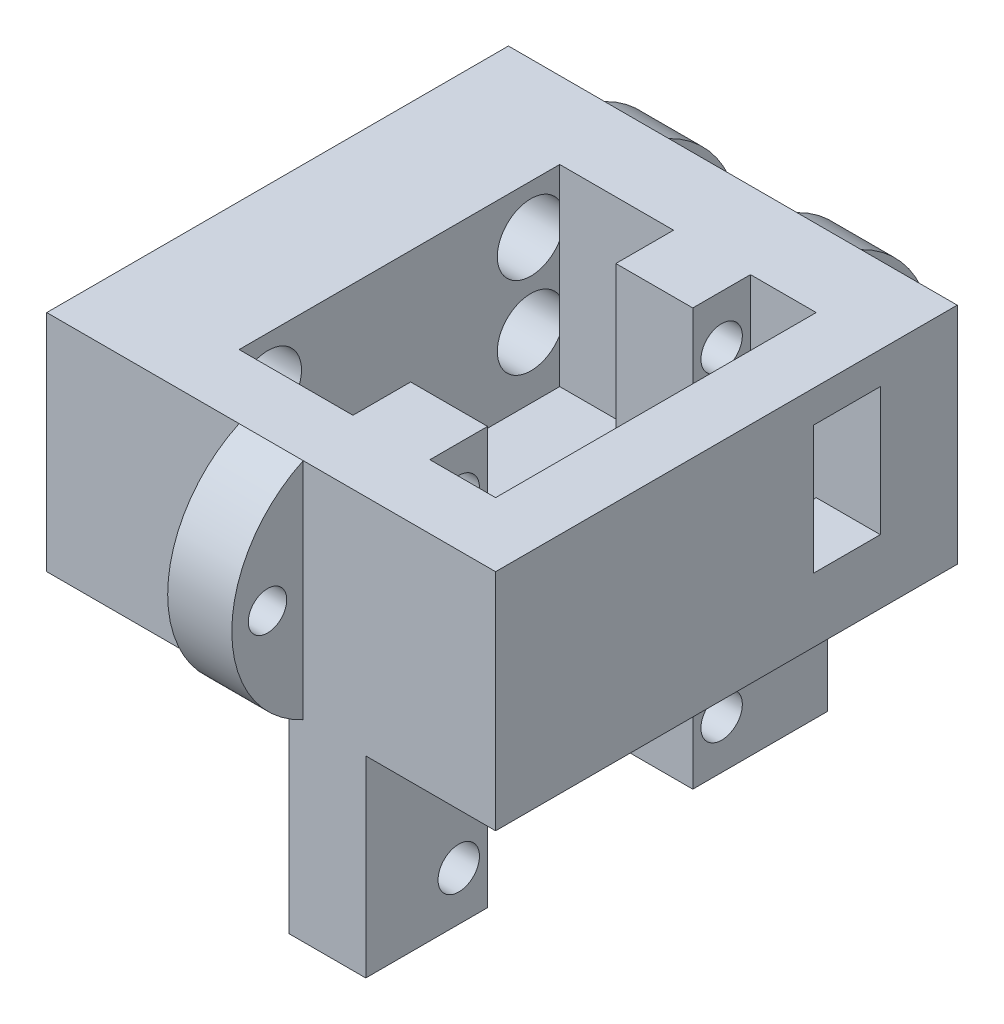
from build123d import *

# Parameters (mm, degrees)
SKETCH1_W                = 88.9
SKETCH1_H                = 91.44
BOSS_EXTRUDE1_DEPTH      = 44.45
CUT_EXTRUDE1_DEPTH       = 38.1
CUT_EXTRUDE2_DEPTH       = 15.24
SKETCH4_R                = 6.64
CUT_EXTRUDE3_DEPTH       = 25.4
SKETCH5_W                = 13.209891204
SKETCH5_H                = 25.4
CUT_EXTRUDE4_DEPTH       = 12.7
BOSS_EXTRUDE2_DEPTH      = 25.4
BOSS_EXTRUDE2_DEPTH_BACK = 25.4
CUT_EXTRUDE6_DEPTH       = 45.72
CUT_EXTRUDE6_DEPTH_BACK  = 2.54
SKETCH9_W                = 12.7
SKETCH9_H                = 18.221589608
BOSS_EXTRUDE4_DEPTH      = 6.35
BOSS_EXTRUDE4_DEPTH_BACK = 6.35
BOSS_EXTRUDE6_DEPTH      = 38.1
SKETCH12_R               = 4.1
CUT_EXTRUDE7_DEPTH       = 98.736331214


with BuildPart() as part:
    # Sketch1 → Boss-Extrude1 (new body)
    with BuildSketch(Plane(origin=(0, 0, 0), x_dir=(1, 0, 0), z_dir=(0, 1, 0))):
        Rectangle(SKETCH1_W, SKETCH1_H)
    extrude(amount=BOSS_EXTRUDE1_DEPTH)

    # Sketch2 → Cut-Extrude1 (cut)
    with BuildSketch(Plane(origin=(0, 44.45, 0), x_dir=(1, 0, 0), z_dir=(0, 1, 0))):
        Polygon((-19.05, 30.48), (-19.05, -33.02), (3.496943095, -33.02), (3.496943095, -21.59), (18.736943095, -21.59), (18.736943095, -33.02), (31.75, -33.02), (31.75, 30.48), (18.736943095, 30.48), (18.736943095, 19.05), (3.496943095, 19.05), (3.496943095, 30.48), align=None)
    extrude(amount=-CUT_EXTRUDE1_DEPTH, mode=Mode.SUBTRACT)

    # Sketch3 → Cut-Extrude2 (cut)
    with BuildSketch(Plane.ZY.offset(-3.496943095)):
        with BuildLine():
            ThreePointArc((-24.765, 22.642), (-28.865, 18.542), (-24.765, 14.442))
            Line((-24.765, 14.442), (-24.765, 22.642))
        make_face()
        with BuildLine():
            Line((-24.765, 22.642), (-24.765, 14.442))
            ThreePointArc((-24.765, 14.442), (-21.865862197, 15.642862197), (-20.665, 18.542))
            ThreePointArc((-20.665, 18.542), (-21.865862197, 21.441137803), (-24.765, 22.642))
        make_face()
        with BuildLine():
            ThreePointArc((-24.765, 22.642), (-28.865, 18.542), (-24.765, 14.442))
            Line((-24.765, 14.442), (-24.765, 22.642))
        make_face()
        with BuildLine():
            Line((-24.765, 22.642), (-24.765, 14.442))
            ThreePointArc((-24.765, 14.442), (-21.865862197, 15.642862197), (-20.665, 18.542))
            ThreePointArc((-20.665, 18.542), (-21.865862197, 21.441137803), (-24.765, 22.642))
        make_face()
        with BuildLine():
            ThreePointArc((-24.765, 38.898), (-28.865, 34.798), (-24.765, 30.698))
            Line((-24.765, 30.698), (-24.765, 38.898))
        make_face()
        with BuildLine():
            Line((-24.765, 38.898), (-24.765, 30.698))
            ThreePointArc((-24.765, 30.698), (-21.865862197, 31.898862197), (-20.665, 34.798))
            ThreePointArc((-20.665, 34.798), (-21.865862197, 37.697137803), (-24.765, 38.898))
        make_face()
        with BuildLine():
            ThreePointArc((-24.765, 38.898), (-28.865, 34.798), (-24.765, 30.698))
            Line((-24.765, 30.698), (-24.765, 38.898))
        make_face()
        with BuildLine():
            Line((-24.765, 38.898), (-24.765, 30.698))
            ThreePointArc((-24.765, 30.698), (-21.865862197, 31.898862197), (-20.665, 34.798))
            ThreePointArc((-20.665, 34.798), (-21.865862197, 37.697137803), (-24.765, 38.898))
        make_face()
        with BuildLine():
            ThreePointArc((27.305, 22.642), (23.205, 18.542), (27.305, 14.442))
            Line((27.305, 14.442), (27.305, 22.642))
        make_face()
        with BuildLine():
            Line((27.305, 22.642), (27.305, 14.442))
            ThreePointArc((27.305, 14.442), (30.204137803, 15.642862197), (31.405, 18.542))
            ThreePointArc((31.405, 18.542), (30.204137803, 21.441137803), (27.305, 22.642))
        make_face()
        with BuildLine():
            ThreePointArc((27.305, 22.642), (23.205, 18.542), (27.305, 14.442))
            Line((27.305, 14.442), (27.305, 22.642))
        make_face()
        with BuildLine():
            Line((27.305, 22.642), (27.305, 14.442))
            ThreePointArc((27.305, 14.442), (30.204137803, 15.642862197), (31.405, 18.542))
            ThreePointArc((31.405, 18.542), (30.204137803, 21.441137803), (27.305, 22.642))
        make_face()
        with BuildLine():
            ThreePointArc((27.305, 38.898), (23.205, 34.798), (27.305, 30.698))
            Line((27.305, 30.698), (27.305, 38.898))
        make_face()
        with BuildLine():
            Line((27.305, 38.898), (27.305, 30.698))
            ThreePointArc((27.305, 30.698), (30.204137803, 31.898862197), (31.405, 34.798))
            ThreePointArc((31.405, 34.798), (30.204137803, 37.697137803), (27.305, 38.898))
        make_face()
        with BuildLine():
            ThreePointArc((27.305, 38.898), (23.205, 34.798), (27.305, 30.698))
            Line((27.305, 30.698), (27.305, 38.898))
        make_face()
        with BuildLine():
            Line((27.305, 38.898), (27.305, 30.698))
            ThreePointArc((27.305, 30.698), (30.204137803, 31.898862197), (31.405, 34.798))
            ThreePointArc((31.405, 34.798), (30.204137803, 37.697137803), (27.305, 38.898))
        make_face()
    extrude(amount=-CUT_EXTRUDE2_DEPTH, mode=Mode.SUBTRACT)

    # Sketch4 → Cut-Extrude3 (cut)
    with BuildSketch(Plane.ZY.offset(44.45)):
        with Locations((-24.765, 18.542)):
            Circle(SKETCH4_R)
        with Locations((-24.765, 34.798)):
            Circle(SKETCH4_R)
        with Locations((27.305, 18.542)):
            Circle(SKETCH4_R)
        with Locations((27.305, 34.798)):
            Circle(SKETCH4_R)
    extrude(amount=-CUT_EXTRUDE3_DEPTH, mode=Mode.SUBTRACT)

    # Sketch5 → Cut-Extrude4 (cut)
    with BuildSketch(Plane.ZY.offset(-31.75)):
        with Locations((-23.875054398, 25.4)):
            Rectangle(SKETCH5_W, SKETCH5_H)
    extrude(amount=-CUT_EXTRUDE4_DEPTH, mode=Mode.SUBTRACT)

    # Sketch8 → Boss-Extrude2 (add, two sides: drawn at the far end of the back side and taken through both)
    with BuildSketch(Plane(origin=(0, 0, 0), x_dir=(0, 0, -1), z_dir=(1, 0, 0)).offset(-BOSS_EXTRUDE2_DEPTH_BACK)):
        with BuildLine():
            ThreePointArc((48.846831284, 22.225), (52.699055938, 26.077224654), (56.551280591, 22.225))
            Line((56.551280591, 22.225), (59.678111875, 22.225))
            ThreePointArc((59.678111875, 22.225), (55.899195587, 35.347304601), (45.72, 44.45))
            Line((45.72, 44.45), (45.72, 22.225))
            Line((45.72, 22.225), (48.846831284, 22.225))
        make_face()
        with BuildLine():
            Line((59.678111875, 22.225), (56.551280591, 22.225))
            ThreePointArc((56.551280591, 22.225), (52.699055938, 18.372775346), (48.846831284, 22.225))
            Line((48.846831284, 22.225), (45.72, 22.225))
            Line((45.72, 22.225), (45.72, 0))
            ThreePointArc((45.72, 0), (55.899195587, 9.102695399), (59.678111875, 22.225))
        make_face()
        with BuildLine():
            ThreePointArc((48.846831284, 22.225), (52.699055938, 26.077224654), (56.551280591, 22.225))
            Line((56.551280591, 22.225), (59.678111875, 22.225))
            ThreePointArc((59.678111875, 22.225), (55.899195587, 35.347304601), (45.72, 44.45))
            Line((45.72, 44.45), (45.72, 22.225))
            Line((45.72, 22.225), (48.846831284, 22.225))
        make_face()
        with BuildLine():
            Line((59.678111875, 22.225), (56.551280591, 22.225))
            ThreePointArc((56.551280591, 22.225), (52.699055938, 18.372775346), (48.846831284, 22.225))
            Line((48.846831284, 22.225), (45.72, 22.225))
            Line((45.72, 22.225), (45.72, 0))
            ThreePointArc((45.72, 0), (55.899195587, 9.102695399), (59.678111875, 22.225))
        make_face()
    extrude(amount=BOSS_EXTRUDE2_DEPTH + BOSS_EXTRUDE2_DEPTH_BACK)

    # Sketch9 → Cut-Extrude6 (cut, two sides: drawn at the far end of the back side and taken through both)
    with BuildSketch(Plane(origin=(0, 0, 0), x_dir=(1, 0, 0), z_dir=(0, 1, 0)).offset(-CUT_EXTRUDE6_DEPTH_BACK)):
        with Locations((-6.35, 54.830794804)):
            Rectangle(SKETCH9_W, SKETCH9_H)
        with Locations((6.35, 54.830794804)):
            Rectangle(SKETCH9_W, SKETCH9_H)
    extrude(amount=CUT_EXTRUDE6_DEPTH + CUT_EXTRUDE6_DEPTH_BACK, mode=Mode.SUBTRACT)

    # Sketch10 → Boss-Extrude4 (add, two sides: drawn at the far end of the back side and taken through both)
    with BuildSketch(Plane(origin=(0, 0, 0), x_dir=(0, 0, -1), z_dir=(1, 0, 0)).offset(-BOSS_EXTRUDE4_DEPTH_BACK)):
        with BuildLine():
            Line((-45.72, 22.225), (-45.72, 44.45))
            ThreePointArc((-45.72, 44.45), (-56.029860076, 35.397643692), (-59.866502833, 22.225))
            Line((-59.866502833, 22.225), (-56.603251416, 22.225))
            ThreePointArc((-56.603251416, 22.225), (-52.793251416, 26.035), (-48.983251416, 22.225))
            Line((-48.983251416, 22.225), (-45.72, 22.225))
        make_face()
        with BuildLine():
            Line((-45.72, 0), (-45.72, 22.225))
            Line((-45.72, 22.225), (-48.983251416, 22.225))
            ThreePointArc((-48.983251416, 22.225), (-52.793251416, 18.415), (-56.603251416, 22.225))
            Line((-56.603251416, 22.225), (-59.866502833, 22.225))
            ThreePointArc((-59.866502833, 22.225), (-56.029860076, 9.052356308), (-45.72, 0))
        make_face()
        with BuildLine():
            Line((-45.72, 22.225), (-45.72, 44.45))
            ThreePointArc((-45.72, 44.45), (-56.029860076, 35.397643692), (-59.866502833, 22.225))
            Line((-59.866502833, 22.225), (-56.603251416, 22.225))
            ThreePointArc((-56.603251416, 22.225), (-52.793251416, 26.035), (-48.983251416, 22.225))
            Line((-48.983251416, 22.225), (-45.72, 22.225))
        make_face()
        with BuildLine():
            Line((-45.72, 0), (-45.72, 22.225))
            Line((-45.72, 22.225), (-48.983251416, 22.225))
            ThreePointArc((-48.983251416, 22.225), (-52.793251416, 18.415), (-56.603251416, 22.225))
            Line((-56.603251416, 22.225), (-59.866502833, 22.225))
            ThreePointArc((-59.866502833, 22.225), (-56.029860076, 9.052356308), (-45.72, 0))
        make_face()
    extrude(amount=BOSS_EXTRUDE4_DEPTH + BOSS_EXTRUDE4_DEPTH_BACK)

    # Sketch11 → Boss-Extrude6 (add)
    with BuildSketch(Plane.XZ):
        Polygon((18.736943095, 33.02), (18.736943095, 21.59), (3.496943095, 21.59), (3.496943095, 33.02), (3.496943095, 45.72), (18.736943095, 45.72), align=None)
        Polygon((18.736943095, -30.48), (18.736943095, -19.05), (3.496943095, -19.05), (3.496943095, -30.48), (3.496943095, -45.72), (18.736943095, -45.72), align=None)
    extrude(amount=BOSS_EXTRUDE6_DEPTH)

    # Sketch12 → Cut-Extrude7 (cut, through all)
    with BuildSketch(Plane(origin=(18.736943095, 0, 0), x_dir=(0, 0, -1), z_dir=(1, 0, 0))):
        with Locations((24.765, -12.192)):
            Circle(SKETCH12_R)
        with Locations((24.765, -28.448)):
            Circle(SKETCH12_R)
        with Locations((-27.305, -12.192)):
            Circle(SKETCH12_R)
        with Locations((-27.305, -28.448)):
            Circle(SKETCH12_R)
    extrude(amount=-CUT_EXTRUDE7_DEPTH, mode=Mode.SUBTRACT)


solid = part.part
